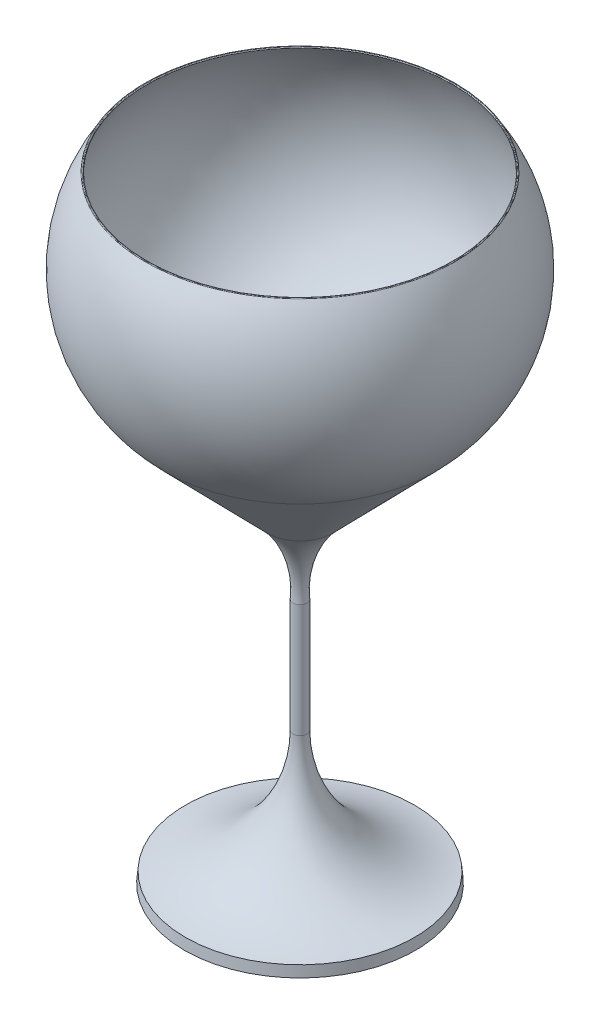
from build123d import *


with BuildPart() as part:
    # Sketch2 → Revolve2 (revolve)
    with BuildSketch(Plane.XY, mode=Mode.PRIVATE) as revolve2_sk:
        with BuildLine():
            Line((0, 101.671970858), (0, 4))
            ThreePointArc((0, 4), (9.534625892, 3.082490861), (18.719327529, 0.363636364))
            ThreePointArc((18.719327529, 0.363636364), (19.637797693, 0.091750914), (20.591260282, 0))
            Line((20.591260282, 0), (37.5, 0))
            Line((37.5, 0), (37.193789678, 3.5))
            ThreePointArc((37.193789678, 3.5), (12.231269073, 16.742888316), (2.25, 43.179147385))
            Line((2.25, 43.179147385), (2.25, 80))
            ThreePointArc((2.25, 80), (3.830233784, 92.873784274), (10.697109842, 103.877305235))
            Line((10.697109842, 103.877305235), (43.948473478, 137.771969054))
            ThreePointArc((43.948473478, 137.771969054), (58, 167.733352934), (50.261089802, 199.908486043))
            ThreePointArc((50.261089802, 199.908486043), (50.188732557, 199.975637708), (50.093069629, 200))
            Line((50.093069629, 200), (49.909428972, 200))
            ThreePointArc((49.909428972, 200), (49.733695381, 199.895486675), (49.74162681, 199.69117705))
            ThreePointArc((49.74162681, 199.69117705), (57.184722445, 165.654365915), (40.334398728, 135.15894371))
            Line((40.334398728, 135.15894371), (10.410946134, 104.656574631))
            ThreePointArc((10.410946134, 104.656574631), (8.816212583, 103.564458635), (6.926416881, 103.158792945))
            ThreePointArc((6.926416881, 103.158792945), (3.467597321, 102.394936138), (0, 101.671970858))
        make_face()
    revolve(revolve2_sk.sketch.rotate(Axis((0, 0, 0), (0, 1, 0)), 90), axis=Axis((0, 0, 0), (0, 1, 0)))


solid = part.part
